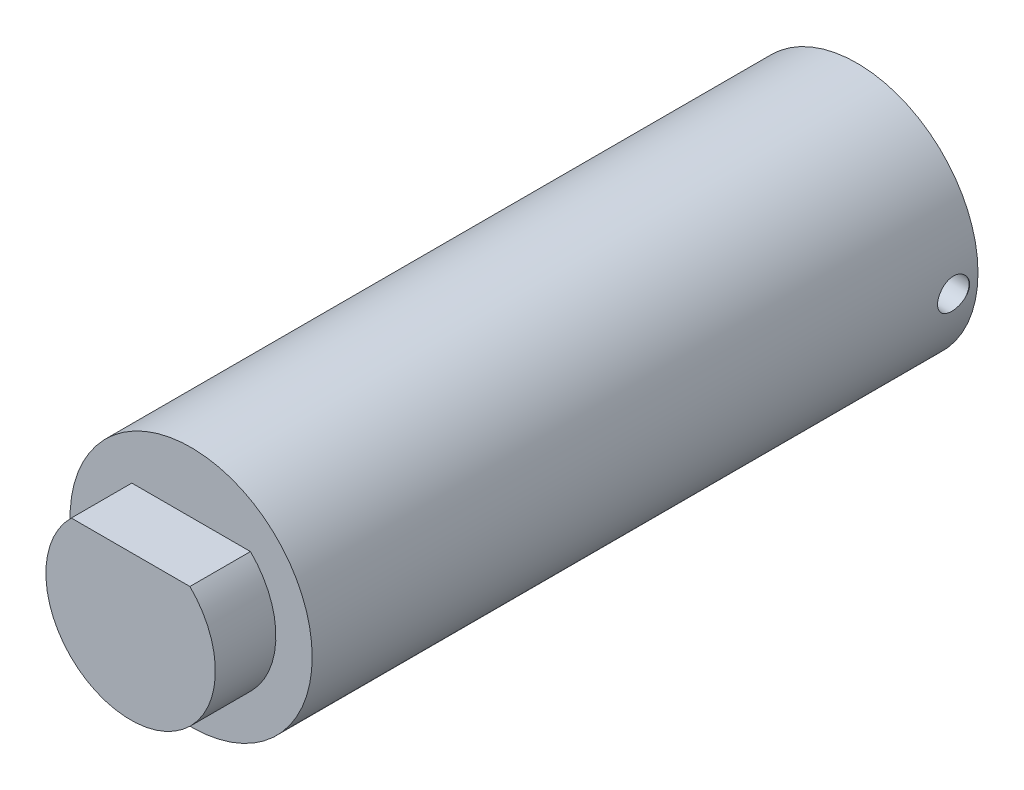
from build123d import *

# Parameters (mm, degrees)
ESBO_O1_R                         = 10
RESSALTO_EXTRUS_O1_DEPTH          = 60
CORTE_EXTRUS_O1_START             = -5
ESBO_O7_R                         = 10
ESBO_O7_R_2                       = 7
CORTE_EXTRUS_O1_DEPTH             = 5
CORTE_EXTRUS_O2_START             = -5
CORTE_EXTRUS_O2_DEPTH             = 5
FURO_COM_FOLGA_DE_M21_D           = 2.6
FURO_COM_FOLGA_DE_M21_CSINK_D     = 2.65
FURO_COM_FOLGA_DE_M21_CSINK_ANGLE = 90


with BuildPart() as part:
    # Esboço1 → Ressalto-extrusão1 (new body)
    with BuildSketch(Plane.XY):
        Circle(ESBO_O1_R)
    extrude(amount=RESSALTO_EXTRUS_O1_DEPTH)

    # Esboço7 → Corte-extrusão1 (cut)
    with BuildSketch(Plane.XY.offset(60).offset(CORTE_EXTRUS_O1_START)):
        Circle(ESBO_O7_R)
        Circle(ESBO_O7_R_2, mode=Mode.SUBTRACT)
    extrude(amount=CORTE_EXTRUS_O1_DEPTH, mode=Mode.SUBTRACT)

    # Esboço9 → Corte-extrusão2 (cut)
    with BuildSketch(Plane.XY.offset(60).offset(CORTE_EXTRUS_O2_START)):
        with BuildLine():
            Line((-4.898979486, 5), (4.898979486, 5))
            ThreePointArc((4.898979486, 5), (0, 7), (-4.898979486, 5))
        make_face()
    extrude(amount=CORTE_EXTRUS_O2_DEPTH, mode=Mode.SUBTRACT)

    # Furo com folga de M21 (through all)
    with Locations(Plane(origin=(9.984543834, -0.555773718, 2), x_dir=(0.055577371817, 0.998454383406, 0), z_dir=(0.998454383406, -0.055577371817, 0))):
        with Locations((0, 0)):
            CounterSinkHole(FURO_COM_FOLGA_DE_M21_D / 2, FURO_COM_FOLGA_DE_M21_CSINK_D / 2, counter_sink_angle=FURO_COM_FOLGA_DE_M21_CSINK_ANGLE)


solid = part.part
